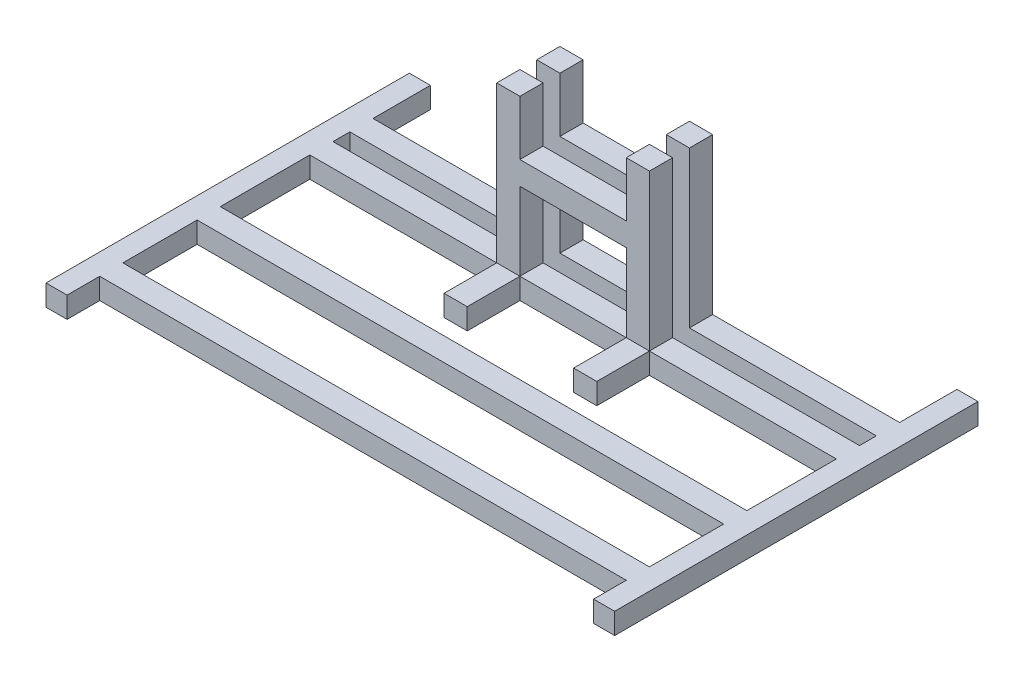
from build123d import *

# Parameters (mm, degrees)
SKETCH1_W           = 1000
SKETCH1_H           = 141
SKETCH1_H_2         = 170
SKETCH1_H_3         = 32
BOSS_EXTRUDE1_DEPTH = 40
SKETCH2_W           = 44
SKETCH2_H           = 44
BOSS_EXTRUDE2_DEPTH = 296
SKETCH3_W           = 44
SKETCH3_H           = 40
BOSS_EXTRUDE3_DEPTH = 100
SKETCH4_W           = 44
SKETCH4_H           = 44
BOSS_EXTRUDE4_DEPTH = 209


with BuildPart() as part:
    # Sketch1 → Boss-Extrude1 (new body)
    with BuildSketch(Plane(origin=(0, 0, 0), x_dir=(1, 0, 0), z_dir=(0, 1, 0))):
        Polygon((-500, 236), (-500, 345), (-540, 345), (-540, -345), (-500, -345), (-500, -283), (500, -283), (500, -345), (540, -345), (540, 345), (500, 345), (500, 236), align=None)
        with Locations((0, -168.5)):
            Rectangle(SKETCH1_W, SKETCH1_H, mode=Mode.SUBTRACT)
        with Locations((0, 31)):
            Rectangle(SKETCH1_W, SKETCH1_H_2, mode=Mode.SUBTRACT)
        with Locations((0, 176)):
            Rectangle(SKETCH1_W, SKETCH1_H_3, mode=Mode.SUBTRACT)
    extrude(amount=BOSS_EXTRUDE1_DEPTH)

    # Sketch2 → Boss-Extrude2 (add)
    with BuildSketch(Plane(origin=(0, 40, 0), x_dir=(1, 0, 0), z_dir=(0, 1, 0))):
        with Locations((-123, 214)):
            Rectangle(SKETCH2_W, SKETCH2_H)
        with Locations((123, 214)):
            Rectangle(SKETCH2_W, SKETCH2_H)
        with Locations((-123, 138)):
            Rectangle(SKETCH2_W, SKETCH2_H)
        with Locations((123, 138)):
            Rectangle(SKETCH2_W, SKETCH2_H)
    extrude(amount=BOSS_EXTRUDE2_DEPTH)

    # Sketch3 → Boss-Extrude3 (add)
    with BuildSketch(Plane.XY.offset(-116)):
        with Locations((-123, 20)):
            Rectangle(SKETCH3_W, SKETCH3_H)
        with Locations((123, 20)):
            Rectangle(SKETCH3_W, SKETCH3_H)
    extrude(amount=BOSS_EXTRUDE3_DEPTH)

    # Sketch4 → Boss-Extrude4 (add)
    with BuildSketch(Plane(origin=(-101, 0, 0), x_dir=(0, 0, -1), z_dir=(1, 0, 0))):
        with Locations((138, 210)):
            Rectangle(SKETCH4_W, SKETCH4_H)
        with Locations((214, 210)):
            Rectangle(SKETCH4_W, SKETCH4_H)
    extrude(amount=BOSS_EXTRUDE4_DEPTH)


solid = part.part
